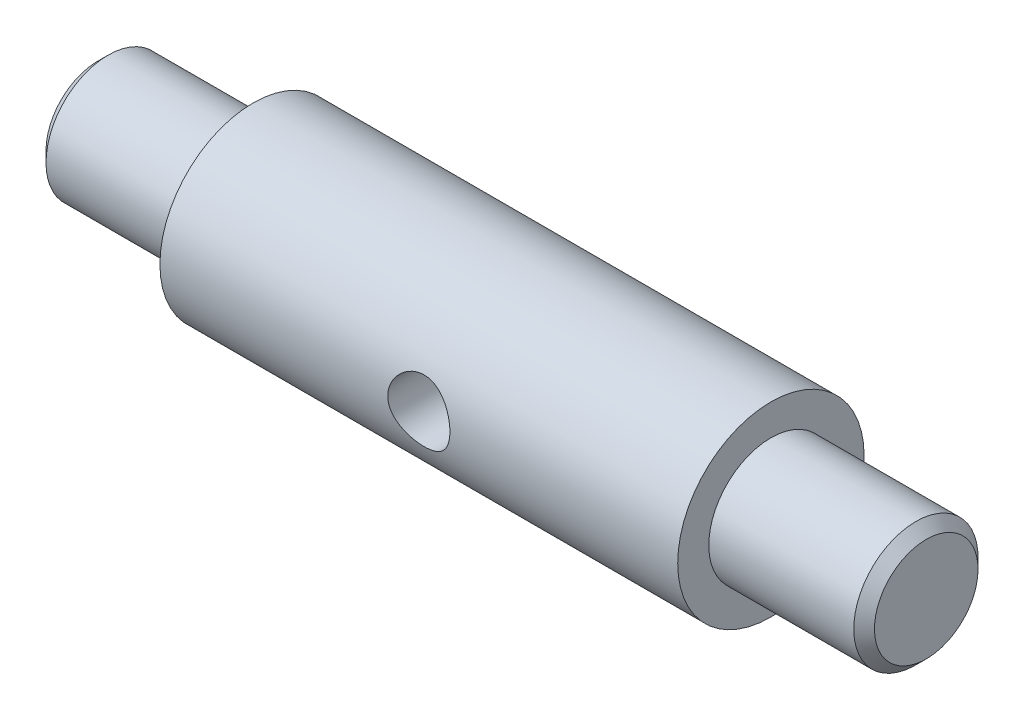
from build123d import *

# Parameters (mm, degrees)
SKETCH2_R          = 3
CUT_EXTRUDE2_DEPTH = 25
CHAMFER1_SIZE      = 1
CHAMFER2_SIZE      = 1
SKETCH3_R          = 3
CUT_EXTRUDE3_DEPTH = 45


with BuildPart() as part:
    # Sketch1 → Revolve1 (revolve)
    with BuildSketch(Plane.XY):
        Polygon((0, 0), (0, 6), (15, 6), (15, 9), (65, 9), (65, 6), (80, 6), (80, 0), align=None)
    revolve(axis=Axis((80, 0, 0), (-1, 0, 0)))

    # Sketch2 → Cut-Extrude2 (cut, symmetric)
    with BuildSketch(Plane.XY):
        with Locations((40, 0)):
            Circle(SKETCH2_R)
    extrude(amount=CUT_EXTRUDE2_DEPTH, both=True, mode=Mode.SUBTRACT)

    # Chamfer1
    chamfer1_edges = [part.edges().sort_by_distance(p)[0] for p in [
        (0, -6, 0),
    ]]
    chamfer(chamfer1_edges, length=CHAMFER1_SIZE)

    # Chamfer2
    chamfer2_edges = [part.edges().sort_by_distance(p)[0] for p in [
        (80, -6, 0),
    ]]
    chamfer(chamfer2_edges, length=CHAMFER2_SIZE)

    # Sketch3 → Cut-Extrude3 (cut)
    with BuildSketch(Plane.ZY):
        with Locations(Location((0, 0, 0), (0, 0, 270))):
            Circle(SKETCH3_R)
    extrude(amount=-CUT_EXTRUDE3_DEPTH, mode=Mode.SUBTRACT)


solid = part.part
